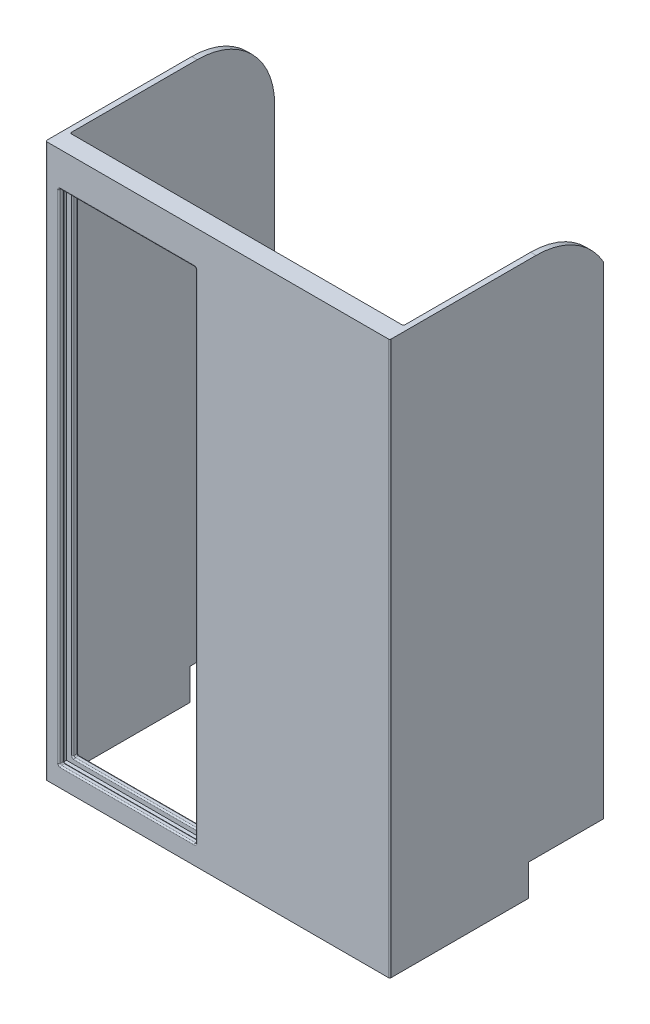
from build123d import *

# Parameters (mm, degrees)
SURFACE_EXTRUDE1_1_DEPTH = 2027
THICKEN1_T2              = 20
CUT_EXTRUDE1_REACH       = 2504.773
SKETCH3_W                = 500
SKETCH3_H                = 1900
CUT_EXTRUDE2_DEPTH       = 20
BOSS_EXTRUDE1_DEPTH      = 50
SKETCH7_W                = 70
SKETCH7_H                = 70
BOSS_EXTRUDE2_DEPTH      = 500
CUT_EXTRUDE3_DEPTH       = 523
CUT_EXTRUDE3_DEPTH_BACK  = 645
SKETCH6_W                = 30
SKETCH6_H                = 1870
FILLET1_R                = 5
CUT_EXTRUDE4_REACH       = 2504.773
SKETCH9_W                = 20
SKETCH9_H                = 36
CUT_EXTRUDE5_DEPTH       = 1996


with BuildPart() as body_1:
    # Surface-Extrude1: a surface, the sketch's curves swept straight by 2027 mm
    with BuildLine(Plane(origin=(0, 0, 0), x_dir=(1, 0, 0), z_dir=(0, 1, 0)), mode=Mode.PRIVATE) as surface_extrude1_1_path:
        Line((-1222, 750), (-1222, 0))
        Line((-1222, 0), (0, 0))
        Line((0, 0), (0, 750))
    surface_extrude1_1 = Shell.extrude(surface_extrude1_1_path.wire(), (0 * SURFACE_EXTRUDE1_1_DEPTH, 1 * SURFACE_EXTRUDE1_1_DEPTH, 0 * SURFACE_EXTRUDE1_1_DEPTH))
    add(Solid.thicken(surface_extrude1_1, -THICKEN1_T2))

    # Cut-Extrude1: up to this face of the body (flat: up to its plane)
    cut_extrude1_end = Plane(body_1.part.faces().sort_by_distance((-1242, 1013.5, -365))[0])
    # Sketch2 → Cut-Extrude1 (cut, up to the picked face)
    with BuildSketch(Plane(origin=(20, 0, 0), x_dir=(0, 0, -1), z_dir=(1, 0, 0)), mode=Mode.PRIVATE) as cut_extrude1_sk1:
        with BuildLine():
            Line((466, 2027), (750, 2027))
            Line((750, 2027), (750, 1743))
            ThreePointArc((750, 1743), (666.818325857, 1943.818325857), (466, 2027))
        make_face()
    cut_extrude1_tool1 = split(extrude(cut_extrude1_sk1.sketch, amount=-CUT_EXTRUDE1_REACH, mode=Mode.PRIVATE), bisect_by=cut_extrude1_end, keep=Keep.BOTH, mode=Mode.PRIVATE)
    add(cut_extrude1_tool1.solids().sort_by(Axis((20, 1963.563505, -686.563505), (-1, 0, 0)))[0], mode=Mode.SUBTRACT)

    # Sketch3 → Cut-Extrude2 (cut)
    with BuildSketch(Plane.XY.offset(20)):
        with Locations((-942, 950)):
            Rectangle(SKETCH3_W, SKETCH3_H)
    extrude(amount=-CUT_EXTRUDE2_DEPTH, mode=Mode.SUBTRACT)

    # Sketch5 → Boss-Extrude1 (add)
    with BuildSketch(Plane.XY.offset(20)):
        Polygon((20, 0), (20, 2027), (-1242, 2027), (-1242, 0), (-1192, 0), (-1192, 1900), (-692, 1900), (-692, 0), align=None)
    extrude(amount=BOSS_EXTRUDE1_DEPTH)

    # Sketch7 → Boss-Extrude2 (add)
    with BuildSketch(Plane(origin=(-1192, 0, 0), x_dir=(0, 0, -1), z_dir=(1, 0, 0))):
        with Locations((-35, 35)):
            Rectangle(SKETCH7_W, SKETCH7_H)
    extrude(amount=BOSS_EXTRUDE2_DEPTH)

    # Sketch6 → Cut-Extrude3 (cut, two sides: drawn at the far end of the back side and taken through both)
    with BuildSketch(Plane.ZY.offset(692).offset(-CUT_EXTRUDE3_DEPTH_BACK)):
        with Locations((35, 985)):
            Rectangle(SKETCH6_W, SKETCH6_H)
    extrude(amount=CUT_EXTRUDE3_DEPTH + CUT_EXTRUDE3_DEPTH_BACK, mode=Mode.SUBTRACT)

    # Fillet1
    fillet1_edges = [body_1.edges().sort_by_distance(p)[0] for p in [
        (-1242, 1013.5, 70),
        (-942, 1900, 70),
        (-692, 985, 70),
        (-1192, 985, 70),
        (-692, 985, 0),
        (-942, 70, 70),
        (-942, 70, 0),
        (-1192, 70, 10),
        (-692, 70, 10),
        (-692, 70, 60),
        (-1192, 70, 60),
        (-942, 70, 50),
        (-942, 70, 20),
        (-692, 1900, 60),
        (-1192, 1900, 60),
        (-1192, 985, 20),
        (-942, 1900, 20),
        (-692, 985, 20),
        (-692, 985, 50),
        (-942, 1900, 50),
        (-1192, 985, 50),
        (0, 1013.5, 0),
        (-1222, 1013.5, 0),
        (-692, 1900, 10),
        (-942, 1900, 0),
        (-1192, 1900, 10),
        (-1192, 985, 0),
        (20, 1013.5, 70),
    ]]
    fillet(fillet1_edges, radius=FILLET1_R)

    # Sketch8 → Cut-Extrude4 (cut, up to next)
    with BuildSketch(Plane(origin=(20, 0, 0), x_dir=(0, 0, -1), z_dir=(1, 0, 0)), mode=Mode.PRIVATE) as cut_extrude4_sk1:
        Polygon((439, 0), (439.023010168, 115), (750, 115), (750, 0), align=None)
    cut_extrude4_tool1 = extrude(cut_extrude4_sk1.sketch, amount=-CUT_EXTRUDE4_REACH, mode=Mode.PRIVATE) & body_1.part
    add(cut_extrude4_tool1.solids().sort_by_distance((20, 57.499291, -594.505752))[0], mode=Mode.SUBTRACT)
    add(cut_extrude4_tool1.solids().sort_by_distance((20, 57.499291, -594.505752))[1], mode=Mode.SUBTRACT)

    # Sketch9 → Cut-Extrude5 (cut)
    with BuildSketch(Plane(origin=(0, 0, 0), x_dir=(1, 0, 0), z_dir=(0, 1, 0))):
        with Locations((10, 732)):
            Rectangle(SKETCH9_W, SKETCH9_H)
    extrude(amount=CUT_EXTRUDE5_DEPTH, mode=Mode.SUBTRACT)


solid = body_1.part
